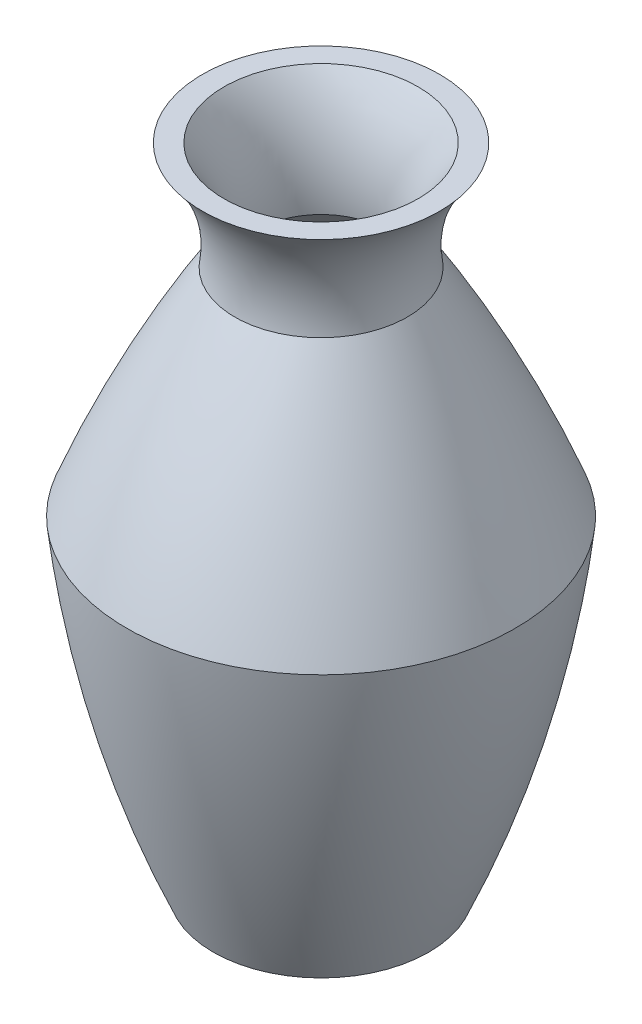
from build123d import *


with BuildPart() as part:
    # 草图1 → 旋转1 (revolve)
    with BuildSketch(Plane.XY, mode=Mode.PRIVATE) as revolve_1_sk:
        with BuildLine():
            Line((0, 0), (25, 0))
            ThreePointArc((25, 0), (37.801935199, 36.75281728), (45, 75))
            ThreePointArc((45, 75), (33.700690007, 100.600345003), (20, 125))
            ThreePointArc((20, 125), (20.949829352, 138.340051194), (27.5, 150))
            Line((27.5, 150), (0, 150))
            Line((0, 150), (0, 0))
        make_face()
    revolve(revolve_1_sk.sketch.rotate(Axis((0, 0, 0), (0, 1, 0)), 90), axis=Axis((0, 0, 0), (0, 1, 0)))

    # 草图2 → 切除-旋转1 (revolve, cut)
    with BuildSketch(Plane.XY, mode=Mode.PRIVATE) as cut_revolve_1_sk:
        with BuildLine():
            Line((0, 10), (26, 10))
            ThreePointArc((26, 10), (35.96997071, 41.860314001), (40, 75))
            ThreePointArc((40, 75), (31.556941504, 102.028470752), (15, 125))
            ThreePointArc((15, 125), (16.408865103, 138.202340469), (22.5, 150))
            Line((22.5, 150), (0, 150))
            Line((0, 150), (0, 10))
        make_face()
    revolve(cut_revolve_1_sk.sketch.rotate(Axis((0, 0, 0), (0, 1, 0)), 90), axis=Axis((0, 0, 0), (0, 1, 0)), mode=Mode.SUBTRACT)


solid = part.part
